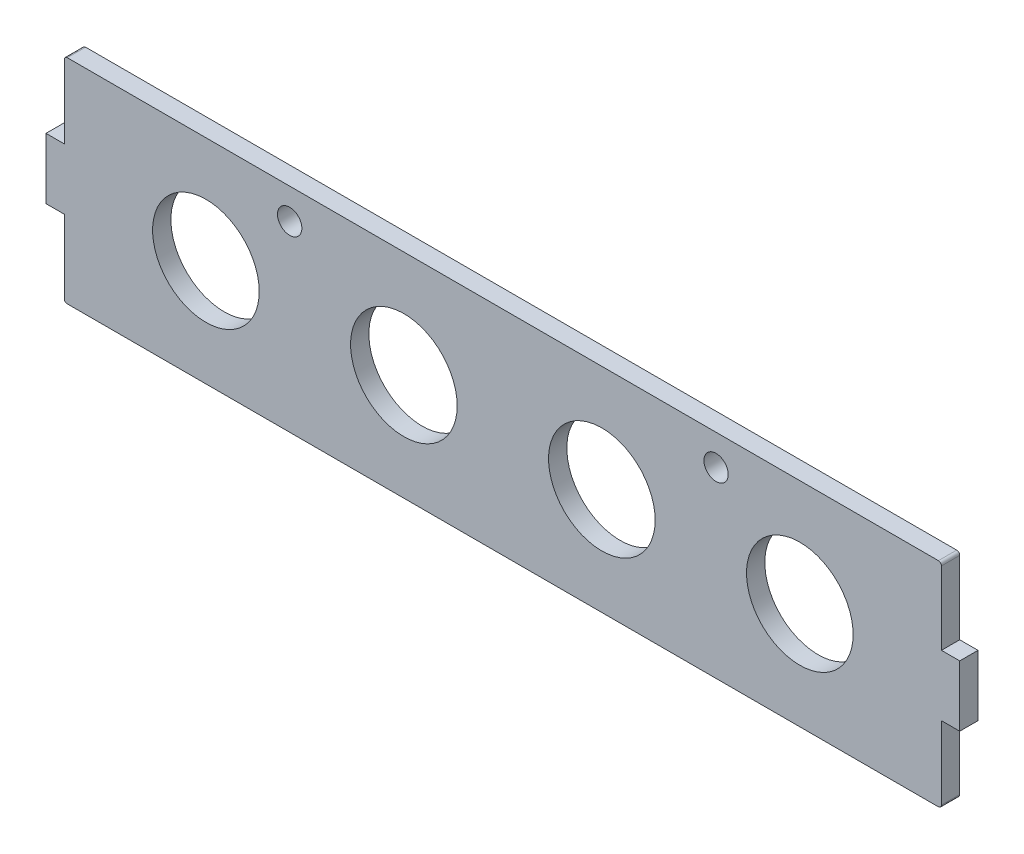
from build123d import *

# Parameters (mm, degrees)
SKETCH1_W   = 300
SKETCH1_H   = 70
FRONT_DEPTH = 6
SKETCH2_W   = 6
SKETCH2_H   = 25
SKETCH2_R   = 4
MOUNT_DEPTH = 309.116860947
FILLET_2_R  = 1
SKETCH3_R   = 17.5
LITE_DEPTH  = 309.116860947


with BuildPart() as part:
    # Sketch1 → front (new body)
    with BuildSketch(Plane.XY):
        with Locations((150, 35)):
            Rectangle(SKETCH1_W, SKETCH1_H)
    extrude(amount=-FRONT_DEPTH)

    # Sketch2 → mount (cut, through all)
    with BuildSketch(Plane.XY):
        with Locations((3, 57.5)):
            Rectangle(SKETCH2_W, SKETCH2_H)
        with Locations((3, 12.5)):
            Rectangle(SKETCH2_W, SKETCH2_H)
        with Locations((297, 57.5)):
            Rectangle(SKETCH2_W, SKETCH2_H)
        with Locations((297, 12.5)):
            Rectangle(SKETCH2_W, SKETCH2_H)
        with Locations((80, 60)):
            Circle(SKETCH2_R)
        with Locations((220, 60)):
            Circle(SKETCH2_R)
    extrude(amount=-MOUNT_DEPTH, mode=Mode.SUBTRACT)

    # fillet 2
    fillet_2_edges = [part.edges().sort_by_distance(p)[0] for p in [
        (6, 70, -3),
        (6, 0, -3),
        (294, 70, -3),
        (294, 0, -3),
    ]]
    fillet(fillet_2_edges, radius=FILLET_2_R)

    # Sketch3 → lite (cut, through all)
    with BuildSketch(Plane.XY):
        with Locations((52.5, 35)):
            Circle(SKETCH3_R)
        with Locations((117.5, 35)):
            Circle(SKETCH3_R)
        with Locations((182.5, 35)):
            Circle(SKETCH3_R)
        with Locations((247.5, 35)):
            Circle(SKETCH3_R)
    extrude(amount=-LITE_DEPTH, mode=Mode.SUBTRACT)


solid = part.part
